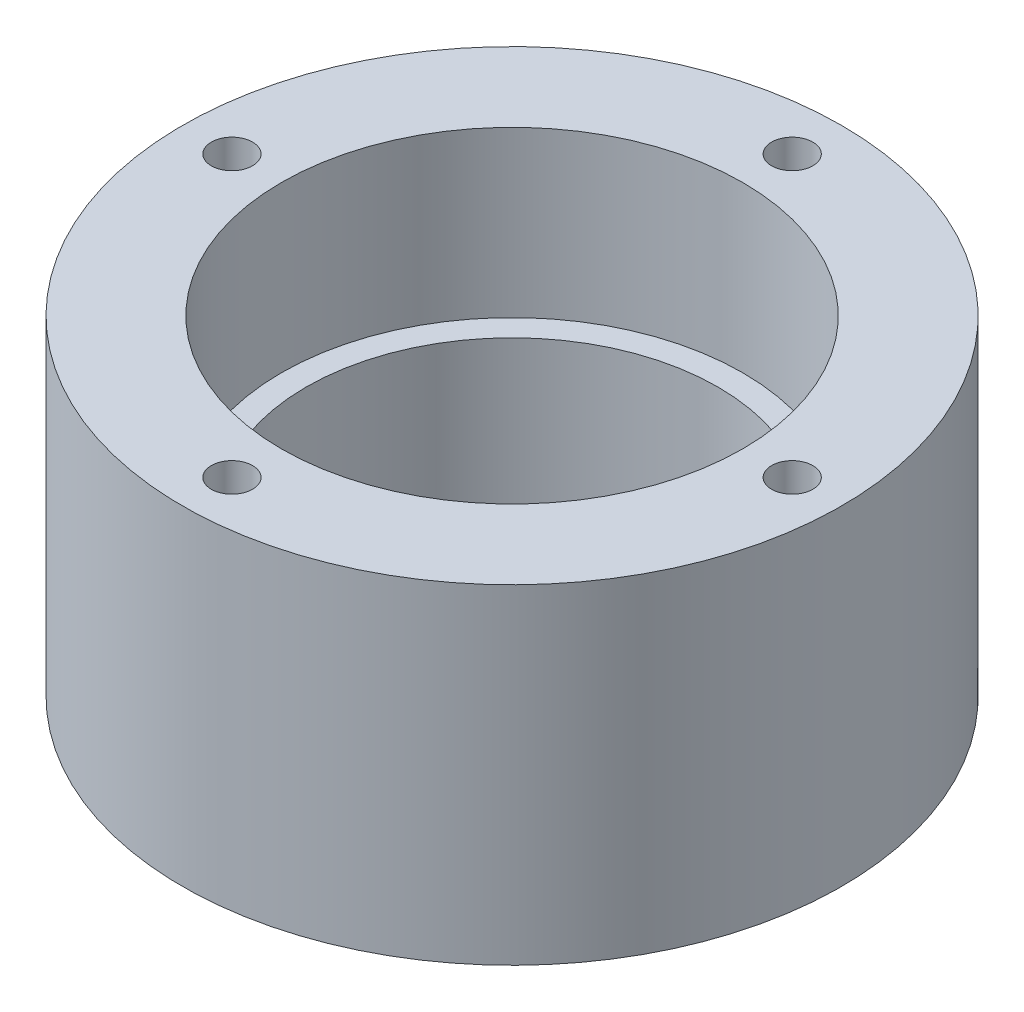
from build123d import *

# Parameters (mm, degrees)
SKETCH1_W                 = 7.5
SKETCH1_H                 = 20
SKETCH2_W                 = 1.5
SKETCH2_H                 = 10
M3X0_5_TAPPED_HOLE1_D     = 2.5
M3X0_5_TAPPED_HOLE1_DEPTH = 8.5
M3X0_5_TAPPED_HOLE1_TIP   = 0.751075774


with BuildPart() as part:
    # Sketch1 → Revolve1 (revolve)
    with BuildSketch(Plane.XY, mode=Mode.PRIVATE) as revolve1_sk:
        with Locations((16.25, 10)):
            Rectangle(SKETCH1_W, SKETCH1_H)
    revolve(revolve1_sk.sketch.rotate(Axis((0, -15.529138296, 0), (0, 1, 0)), 90), axis=Axis((0, -15.529138296, 0), (0, 1, 0)))

    # Sketch2 → Cut-Revolve1 (revolve, cut)
    with BuildSketch(Plane.XY, mode=Mode.PRIVATE) as cut_revolve1_sk:
        with Locations((13.25, 15)):
            Rectangle(SKETCH2_W, SKETCH2_H)
    revolve(cut_revolve1_sk.sketch.rotate(Axis((0, -1.547850983, 0), (0, 1, 0)), 90), axis=Axis((0, -1.547850983, 0), (0, 1, 0)), mode=Mode.SUBTRACT)

    # M3x0.5 Tapped Hole1
    with Locations(Plane(origin=(0, 20, 0), x_dir=(-1, 0, 0), z_dir=(0, 1, 0))):
        with Locations((17, 0), (-17, 0), (0, -17), (0, 17)):
            Hole(M3X0_5_TAPPED_HOLE1_D / 2, depth=M3X0_5_TAPPED_HOLE1_DEPTH)
            with Locations((0, 0, -(M3X0_5_TAPPED_HOLE1_DEPTH + M3X0_5_TAPPED_HOLE1_TIP / 2))):  # 118° drill point
                Cone(0, M3X0_5_TAPPED_HOLE1_D / 2, M3X0_5_TAPPED_HOLE1_TIP, mode=Mode.SUBTRACT)


solid = part.part
